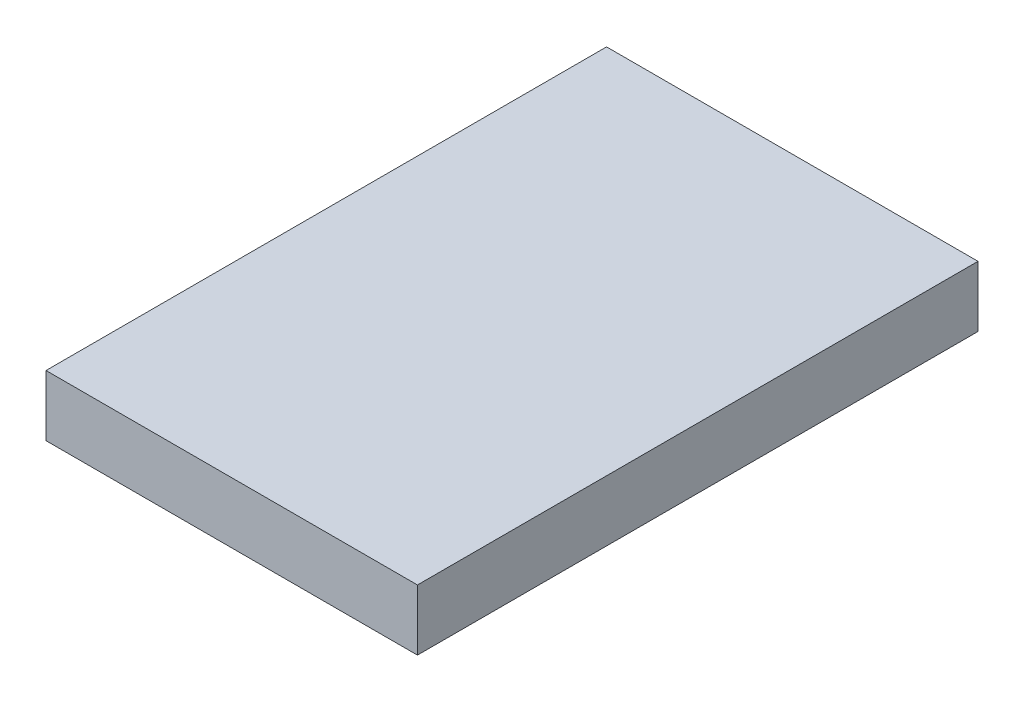
from build123d import *

# Parameters (mm, degrees)
SKETCH1_W           = 55
SKETCH1_H           = 83
BOSS_EXTRUDE1_DEPTH = 9


with BuildPart() as part:
    # Sketch1 → Boss-Extrude1 (new body)
    with BuildSketch(Plane(origin=(0, 0, 0), x_dir=(1, 0, 0), z_dir=(0, 1, 0))):
        Rectangle(SKETCH1_W, SKETCH1_H)
    extrude(amount=BOSS_EXTRUDE1_DEPTH)


solid = part.part
